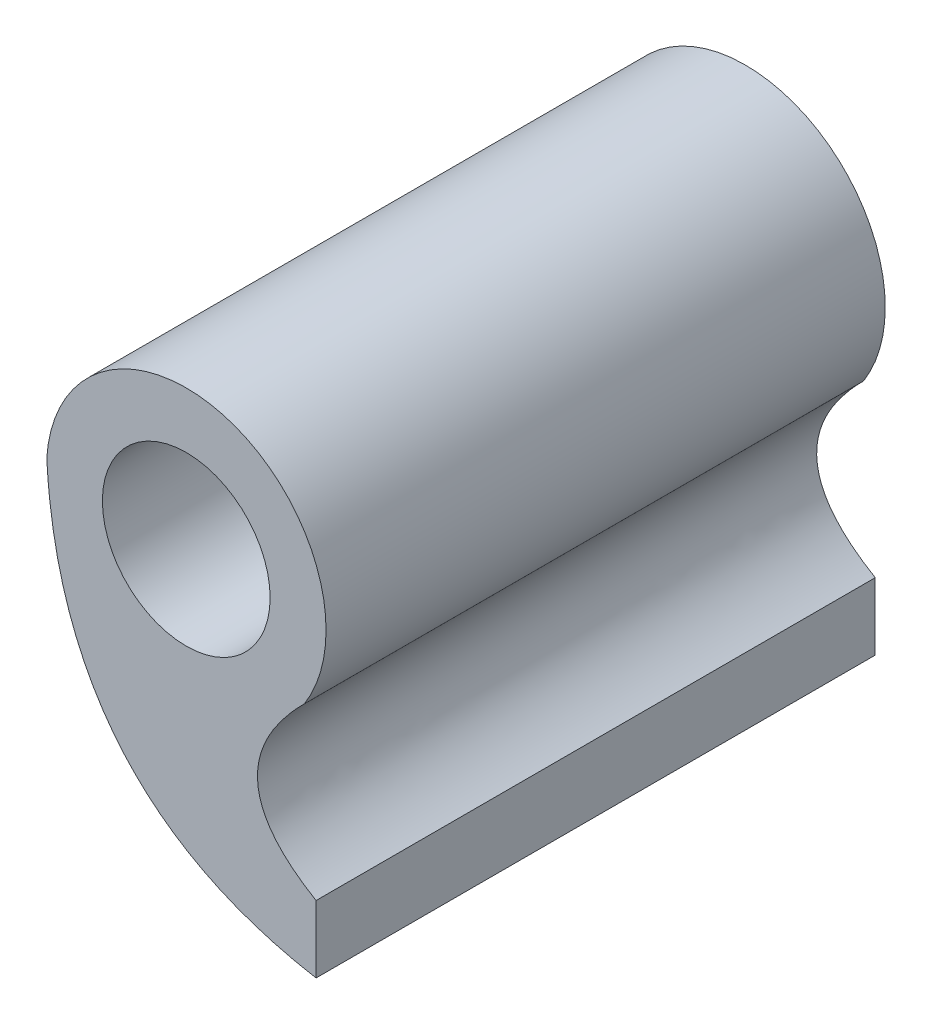
from build123d import *

# Parameters (mm, degrees)
SKETCH2_R           = 15
BOSS_EXTRUDE3_DEPTH = 100


with BuildPart() as part:
    # Sketch2 → Boss-Extrude3 (new body)
    with BuildSketch(Plane.XY):
        with BuildLine():
            add(Edge.make_bspline(
                [(0, 0), (-27.790971102, 4.850972812), (-43.593467312, 21.015270296), (-47.40748863, 48.492892452)],
                knots=[0, 0, 0, 0, 0.824388571, 0.824388571, 0.824388571, 0.824388571], degree=3))
            Line((0, 0), (0, 12))
            add(Edge.make_bspline(
                [(0, 12), (-19.855506459, 23.701138321), (-2.078921696, 41.432276663)],
                knots=[0, 0, 0, 1, 1, 1], degree=2))
            ThreePointArc((-2.078921696, 41.432276663), (-15.477506866, 78.560495393), (-48.159097141, 56.425898768))
            add(Edge.make_bspline(
                [(-47.40748863, 48.492892452), (-47.761040822, 51.040013382), (-48.011576992, 53.684348821), (-48.159097141, 56.425898768)],
                knots=[0.824388571, 0.824388571, 0.824388571, 0.824388571, 0.900807752, 0.900807752, 0.900807752, 0.900807752], degree=3))
        make_face()
        with Locations((-23.212854475, 54.787308872)):
            Circle(SKETCH2_R, mode=Mode.SUBTRACT)
    extrude(amount=BOSS_EXTRUDE3_DEPTH)


solid = part.part
